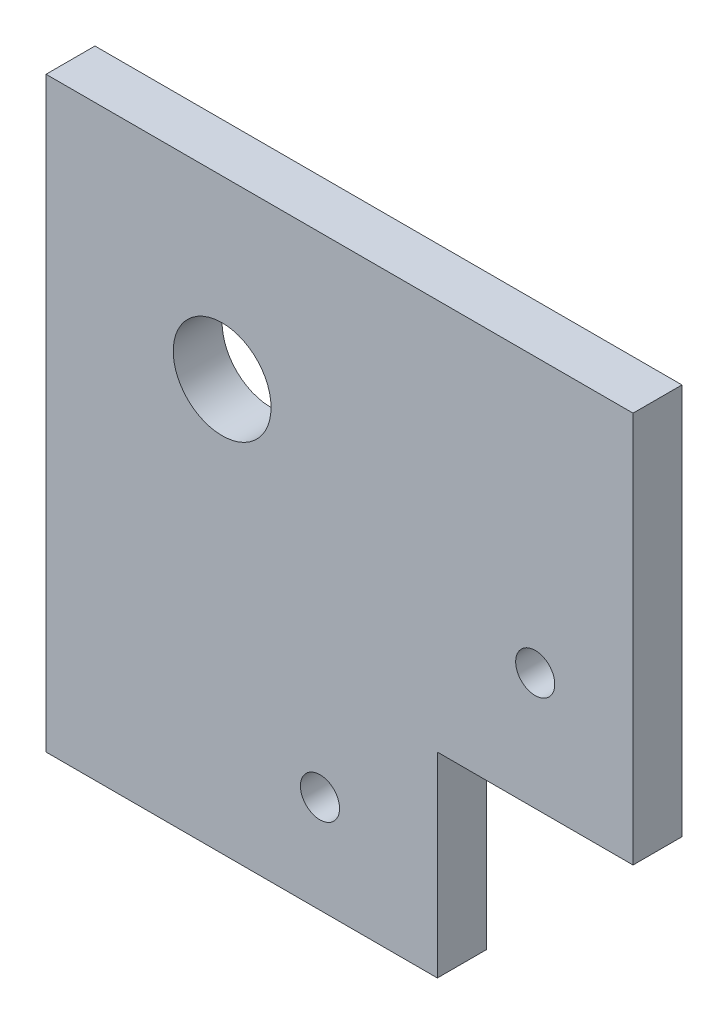
from build123d import *

# Parameters (mm, degrees)
SKETCH1_R           = 5
BOSS_EXTRUDE1_DEPTH = 5
SKETCH2_R           = 2
CUT_EXTRUDE1_DEPTH  = 86


with BuildPart() as part:
    # Sketch1 → Boss-Extrude1 (new body)
    with BuildSketch(Plane.XY):
        Polygon((0, 0), (40, 0), (40, 20), (60, 20), (60, 60), (0, 60), align=None)
        with Locations((18, 42)):
            Circle(SKETCH1_R, mode=Mode.SUBTRACT)
    extrude(amount=BOSS_EXTRUDE1_DEPTH)

    # Sketch2 → Cut-Extrude1 (cut, through all)
    with BuildSketch(Plane(origin=(0, 0, 0), x_dir=(-1, 0, 0), z_dir=(0, 0, -1))):
        with Locations((-50, 32)):
            Circle(SKETCH2_R)
        with Locations((-28, 10)):
            Circle(SKETCH2_R)
    extrude(amount=-CUT_EXTRUDE1_DEPTH, mode=Mode.SUBTRACT)


solid = part.part
